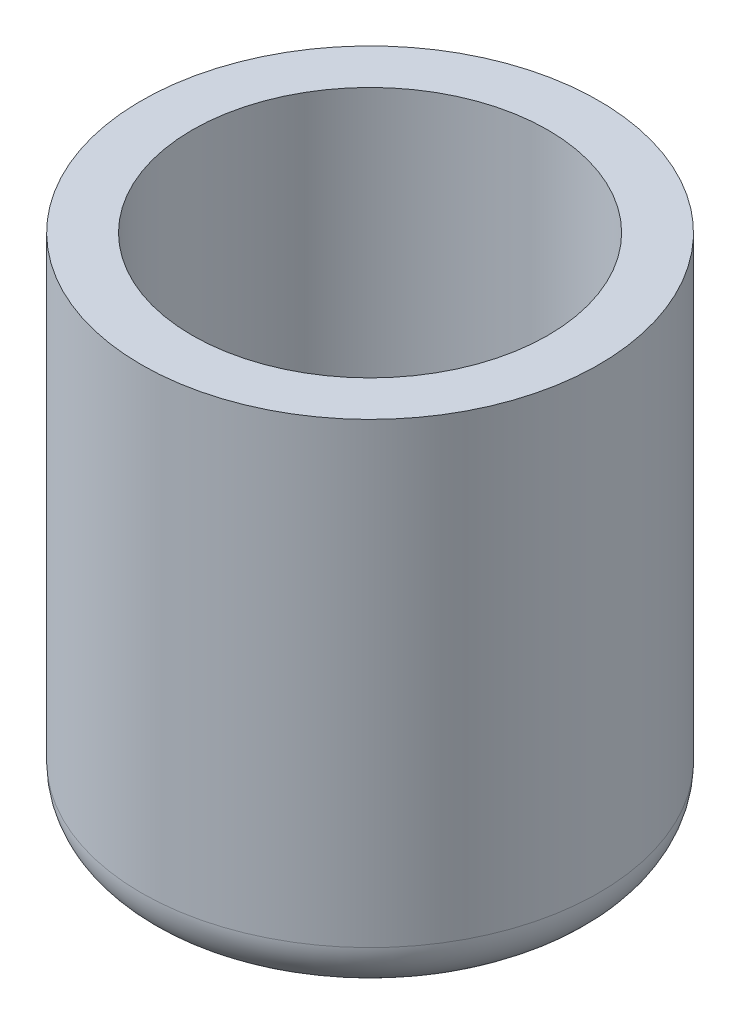
from build123d import *

# Parameters (mm, degrees)
SKETCH1_R           = 4.5
BOSS_EXTRUDE1_DEPTH = 10
SHELL1_T            = -1
FILLET1_R           = 1


with BuildPart() as part:
    # Sketch1 → Boss-Extrude1 (new body)
    with BuildSketch(Plane(origin=(0, 0, 0), x_dir=(1, 0, 0), z_dir=(0, 1, 0))):
        with Locations(Location((0, 0, 0), (0, 0, 270))):
            Circle(SKETCH1_R)
    extrude(amount=BOSS_EXTRUDE1_DEPTH)

    # Shell1
    shell1_openings = [part.faces().sort_by_distance(p)[0] for p in [
        (0, 10, 0),
    ]]
    offset(amount=SHELL1_T, openings=shell1_openings, kind=Kind.INTERSECTION)

    # Sketch4 → Cut-Revolve1 (revolve, cut)
    with BuildSketch(Plane.XY):
        with BuildLine():
            Line((0, 3.5), (0, -1.5))
            ThreePointArc((0, -1.5), (2.5, 1), (0, 3.5))
        make_face()
    revolve(axis=Axis((0, 3.5, 0), (0, -1, 0)), mode=Mode.SUBTRACT)

    # Fillet1
    fillet1_edges = [part.edges().sort_by_distance(p)[0] for p in [
        (0, 0, -4.5),
    ]]
    fillet(fillet1_edges, radius=FILLET1_R)


solid = part.part
